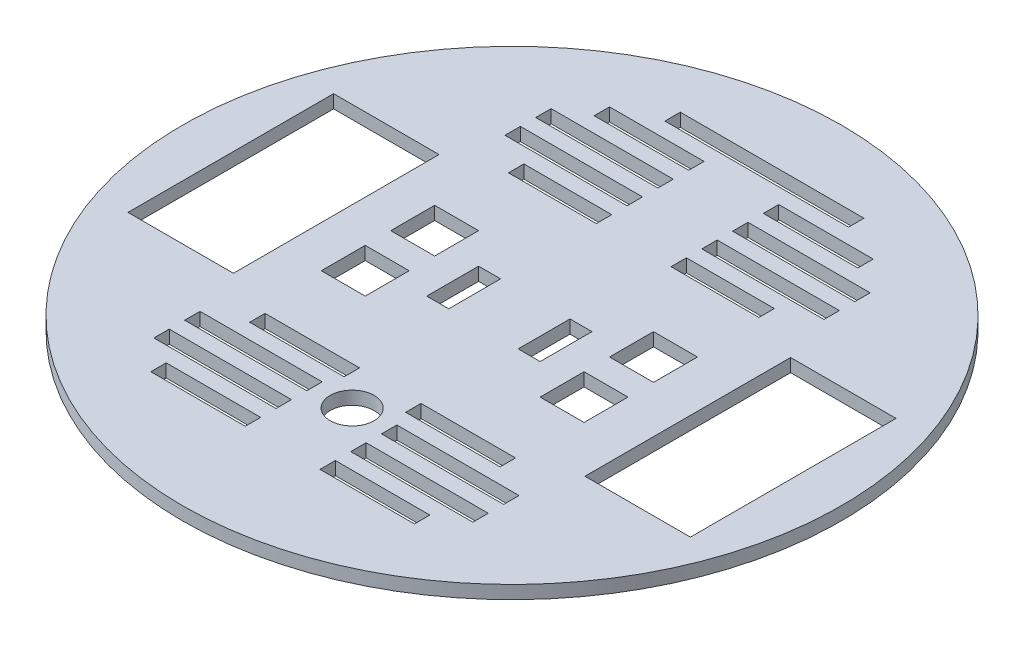
from build123d import *

# Parameters (mm, degrees)
CROQUIS1_R              = 75
CROQUIS1_R_2            = 5
CROQUIS1_W              = 24
CROQUIS1_H              = 46.8
CROQUIS1_W_2            = 41.8
CROQUIS1_H_2            = 3.5
CROQUIS1_W_3            = 10
CROQUIS1_H_3            = 10
CROQUIS1_W_4            = 27.8
CROQUIS1_W_5            = 21.5
CROQUIS1_W_6            = 20
CROQUIS1_W_7            = 5
CROQUIS1_H_4            = 11.8
SALIENTE_EXTRUIR1_DEPTH = 3


with BuildPart() as part:
    # Croquis1 → Saliente-Extruir1 (new body)
    with BuildSketch(Plane.XZ):
        with Locations(Location((-2.614604162, 2.776770239, 0), (0, 0, 270))):
            Circle(CROQUIS1_R)
        with Locations(Location((-2.546416873, 39.226770239, 0), (0, 0, 270))):
            Circle(CROQUIS1_R_2, mode=Mode.SUBTRACT)
        with Locations((49.385395838, 2.776770239)):
            Rectangle(CROQUIS1_W, CROQUIS1_H, mode=Mode.SUBTRACT)
        with Locations((-54.614604162, 2.776770239)):
            Rectangle(CROQUIS1_W, CROQUIS1_H, mode=Mode.SUBTRACT)
        with Locations((-2.614604162, -54.673229761)):
            Rectangle(CROQUIS1_W_2, CROQUIS1_H_2, mode=Mode.SUBTRACT)
        with Locations((21.685395838, 10.676770239)):
            Rectangle(CROQUIS1_W_3, CROQUIS1_H_3, mode=Mode.SUBTRACT)
        with Locations((21.685395838, -5.123229761)):
            Rectangle(CROQUIS1_W_3, CROQUIS1_H_3, mode=Mode.SUBTRACT)
        with Locations((-28.114604162, 10.676770239)):
            Rectangle(CROQUIS1_W_3, CROQUIS1_H_3, mode=Mode.SUBTRACT)
        with Locations((-28.114604162, -5.123229761)):
            Rectangle(CROQUIS1_W_3, CROQUIS1_H_3, mode=Mode.SUBTRACT)
        with Locations((19.785395838, 46.226770239)):
            Rectangle(CROQUIS1_W_4, CROQUIS1_H_2, mode=Mode.SUBTRACT)
        with Locations((19.785395838, 39.226770239)):
            Rectangle(CROQUIS1_W_4, CROQUIS1_H_2, mode=Mode.SUBTRACT)
        with Locations((-25.014604162, 46.226770239)):
            Rectangle(CROQUIS1_W_4, CROQUIS1_H_2, mode=Mode.SUBTRACT)
        with Locations((-25.014604162, 39.226770239)):
            Rectangle(CROQUIS1_W_4, CROQUIS1_H_2, mode=Mode.SUBTRACT)
        with Locations((19.785395838, -33.673229761)):
            Rectangle(CROQUIS1_W_4, CROQUIS1_H_2, mode=Mode.SUBTRACT)
        with Locations((19.785395838, -40.673229761)):
            Rectangle(CROQUIS1_W_4, CROQUIS1_H_2, mode=Mode.SUBTRACT)
        with Locations((-25.014604162, -33.673229761)):
            Rectangle(CROQUIS1_W_4, CROQUIS1_H_2, mode=Mode.SUBTRACT)
        with Locations((-25.014604162, -40.673229761)):
            Rectangle(CROQUIS1_W_4, CROQUIS1_H_2, mode=Mode.SUBTRACT)
        with Locations((-20.364604162, 32.226770239)):
            Rectangle(CROQUIS1_W_5, CROQUIS1_H_2, mode=Mode.SUBTRACT)
        with Locations((16.635395838, 53.226770239)):
            Rectangle(CROQUIS1_W_5, CROQUIS1_H_2, mode=Mode.SUBTRACT)
        with Locations((15.135395838, 32.226770239)):
            Rectangle(CROQUIS1_W_5, CROQUIS1_H_2, mode=Mode.SUBTRACT)
        with Locations((-21.864604162, 53.226770239)):
            Rectangle(CROQUIS1_W_5, CROQUIS1_H_2, mode=Mode.SUBTRACT)
        with Locations((16.635395838, -47.673229761)):
            Rectangle(CROQUIS1_W_5, CROQUIS1_H_2, mode=Mode.SUBTRACT)
        with Locations((-21.864604162, -47.673229761)):
            Rectangle(CROQUIS1_W_5, CROQUIS1_H_2, mode=Mode.SUBTRACT)
        with Locations((15.885395838, -26.673229761)):
            Rectangle(CROQUIS1_W_6, CROQUIS1_H_2, mode=Mode.SUBTRACT)
        with Locations((-21.114604162, -26.673229761)):
            Rectangle(CROQUIS1_W_6, CROQUIS1_H_2, mode=Mode.SUBTRACT)
        with Locations((7.185395838, 2.776770239)):
            Rectangle(CROQUIS1_W_7, CROQUIS1_H_4, mode=Mode.SUBTRACT)
        with Locations((-13.614604162, 2.776770239)):
            Rectangle(CROQUIS1_W_7, CROQUIS1_H_4, mode=Mode.SUBTRACT)
    extrude(amount=-SALIENTE_EXTRUIR1_DEPTH)


solid = part.part
